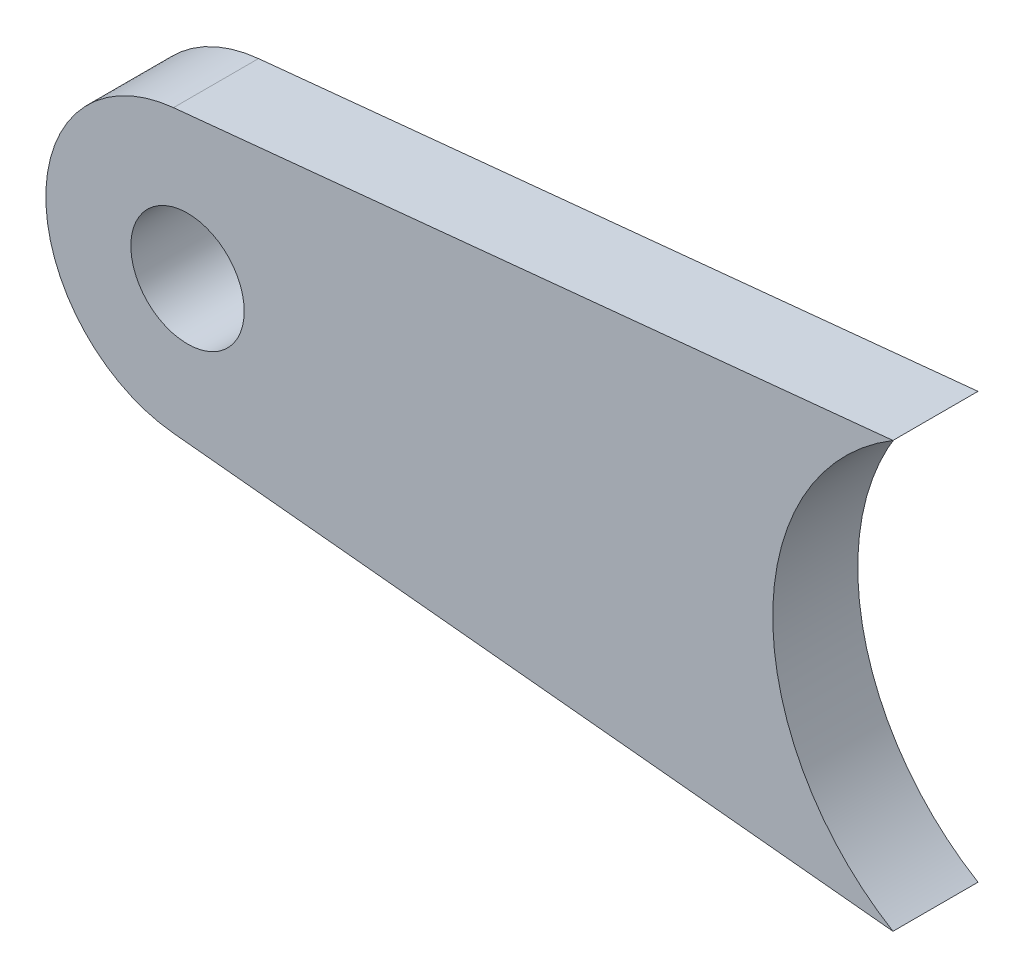
from build123d import *

# Parameters (mm, degrees)
SKETCH2_R           = 8
BOSS_EXTRUDE1_DEPTH = 6


with BuildPart() as part:
    # Sketch2 → Boss-Extrude1 (new, symmetric)
    with BuildSketch(Plane.XY):
        with BuildLine():
            Line((59.787243623, 30), (-41.764019246, 19.901846216))
            ThreePointArc((-41.764019246, 19.901846216), (-59.785, 0), (-41.764019246, -19.901846216))
            Line((-41.764019246, -19.901846216), (59.787243623, -30))
            ThreePointArc((59.787243623, -30), (42.815, 0), (59.787243623, 30))
        make_face()
        with Locations((-39.785, 0)):
            Circle(SKETCH2_R, mode=Mode.SUBTRACT)
    extrude(amount=BOSS_EXTRUDE1_DEPTH, both=True)


solid = part.part
